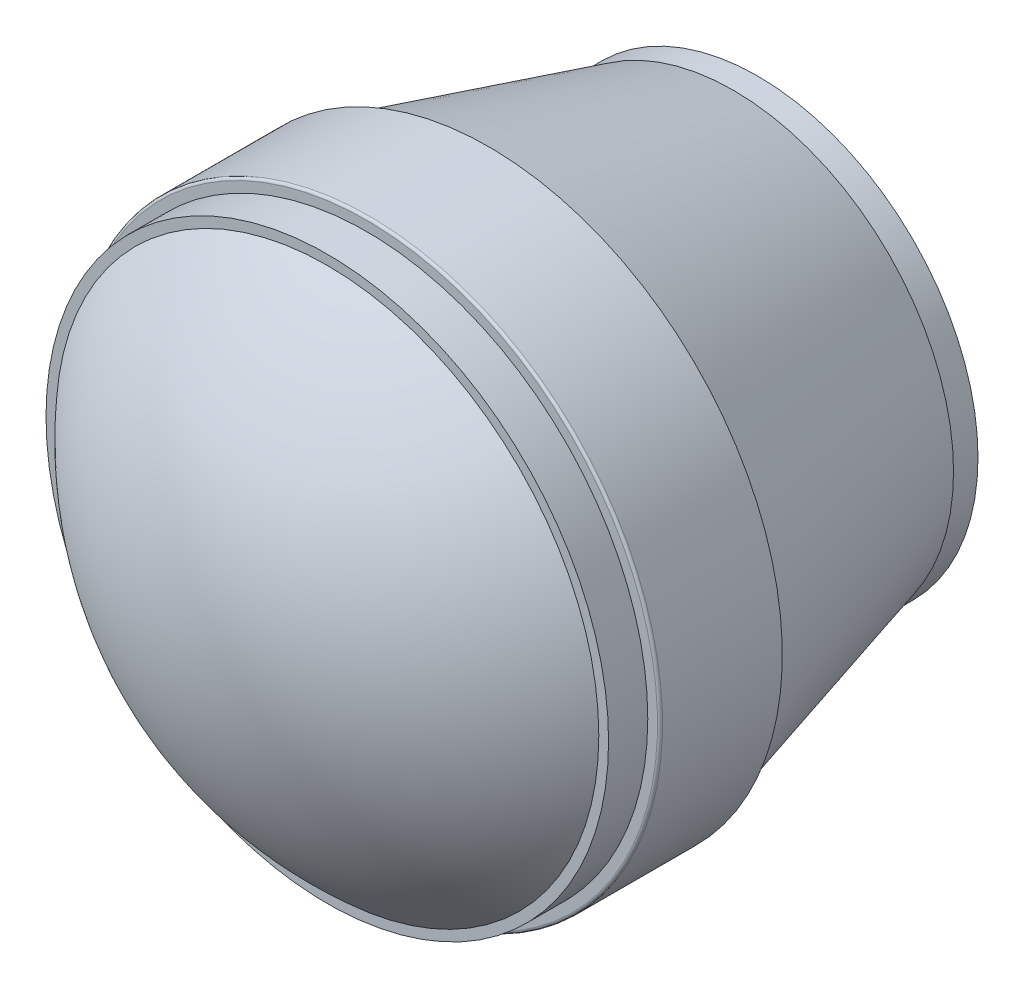
from build123d import *


with BuildPart() as part:
    # Sketch1 → Revolve1 (revolve)
    with BuildSketch(Plane(origin=(0, 0, 0), x_dir=(0, 0, -1), z_dir=(1, 0, 0)), mode=Mode.PRIVATE) as revolve1_sk:
        with BuildLine():
            Line((10, 0), (0, 0))
            add(Edge.make_bspline(
                [(0, 0), (3.5599e-05, 0.016666801), (0.000106798, 0.050001231), (0.000652865, 0.100002577), (0.001541965, 0.1500037), (0.00277976, 0.200005118), (0.00437987, 0.250006415), (0.006342127, 0.300007464), (0.008653546, 0.350008586), (0.011306301, 0.400010647), (0.014344795, 0.450011021), (0.017718859, 0.500012898), (0.021465187, 0.550013422), (0.025546859, 0.600015942), (0.030015342, 0.650015894), (0.03482081, 0.70001787), (0.039992041, 0.750019052), (0.045523257, 0.800020171), (0.051408883, 0.850022422), (0.057677216, 0.900021809), (0.064279583, 0.95002496), (0.071264406, 1.000025161), (0.078604568, 1.05002637), (0.086301292, 1.100028717), (0.094377045, 1.150028529), (0.102799423, 1.20003228), (0.111617788, 1.250030975), (0.120783561, 1.300033624), (0.130325404, 1.350034612), (0.140235292, 1.400035949), (0.150516909, 1.450036918), (0.161163804, 1.500039649), (0.17219876, 1.550039155), (0.183594648, 1.600042195), (0.195380444, 1.65004137), (0.207524249, 1.700045854), (0.220069218, 1.750045189), (0.232988482, 1.800046718), (0.246290189, 1.850047612), (0.259968354, 1.900050402), (0.274039825, 1.950051408), (0.288500418, 2.000052634), (0.303351068, 2.050053844), (0.318592454, 2.100054806), (0.334221213, 2.150057651), (0.350251722, 2.200058963), (0.366685967, 2.250057862), (0.383501889, 2.300062903), (0.40073359, 2.350063852), (0.418376737, 2.400063011), (0.436415737, 2.45006601), (0.454864866, 2.500069094), (0.473738026, 2.550068164), (0.493019727, 2.600068939), (0.512706128, 2.650074525), (0.532830884, 2.700072839), (0.553370049, 2.750076061), (0.574338539, 2.800079744), (0.595755257, 2.85007556), (0.61758101, 2.900081863), (0.639854553, 2.950081918), (0.66256348, 3.000085551), (0.685725632, 3.050086231), (0.7093363, 3.100087577), (0.733399151, 3.150087825), (0.757906071, 3.20009433), (0.782892021, 3.250091412), (0.808327595, 3.300098823), (0.834255389, 3.350093071), (0.860630848, 3.400102473), (0.88750378, 3.450102818), (0.914867347, 3.500100816), (0.942705478, 3.550107403), (0.971049019, 3.600107299), (0.999888878, 3.65011121), (1.029241659, 3.70011152), (1.059102526, 3.750114933), (1.089483632, 3.800118313), (1.120396235, 3.850118736), (1.151837467, 3.900122094), (1.183818601, 3.950125628), (1.216352043, 4.000125498), (1.249431788, 4.050132262), (1.283085623, 4.100131924), (1.317306062, 4.150136161), (1.352110512, 4.200135309), (1.387489417, 4.25014553), (1.423484922, 4.300141599), (1.460075424, 4.350148495), (1.497288074, 4.40015156), (1.53513209, 4.450151014), (1.57360284, 4.500160743), (1.612737012, 4.550160216), (1.652530339, 4.600162877), (1.692991663, 4.65017277), (1.734157348, 4.700168226), (1.776008892, 4.750178192), (1.81858317, 4.800180487), (1.861887951, 4.850182262), (1.905930073, 4.900195432), (1.95075691, 4.950189638), (1.996348781, 5.000203486), (2.042755705, 5.050200606), (2.089969588, 5.100213134), (2.13803612, 5.150217143), (2.186971133, 5.200222711), (2.236797623, 5.250226935), (2.287534309, 5.300237945), (2.339222476, 5.350244315), (2.391888284, 5.400253552), (2.445574222, 5.45025529), (2.500276259, 5.500295659), (2.537351737, 5.533372099), (2.55599, 5.55)],
                knots=[0, 0, 0, 0, 0.007942908, 0.015886211, 0.023830326, 0.031775625, 0.039722547, 0.047671504, 0.055622833, 0.063576922, 0.07153435, 0.079495335, 0.087460381, 0.095429767, 0.10340416, 0.111383685, 0.11936889, 0.127360179, 0.135357957, 0.143362824, 0.151374788, 0.159394667, 0.167422653, 0.175459144, 0.183504791, 0.191559748, 0.199624961, 0.207700294, 0.215786437, 0.223883802, 0.231992798, 0.240113836, 0.248247664, 0.256394356, 0.264554679, 0.272728682, 0.280917534, 0.289121281, 0.297340338, 0.305575119, 0.313826467, 0.322094811, 0.330380581, 0.338684203, 0.347006099, 0.355347174, 0.363707867, 0.372088108, 0.380489342, 0.388912021, 0.397356053, 0.405822412, 0.414312099, 0.422825001, 0.431361552, 0.439923369, 0.448510316, 0.457123451, 0.46576386, 0.474430749, 0.483125841, 0.491849606, 0.500603176, 0.50938703, 0.518201646, 0.527047492, 0.535926456, 0.544838318, 0.553785016, 0.56276558, 0.57178273, 0.580836987, 0.589928093, 0.599058103, 0.608227539, 0.617437722, 0.626689183, 0.635983268, 0.645321349, 0.654703976, 0.664132545, 0.673608478, 0.683132339, 0.69270646, 0.702331431, 0.712008739, 0.721738974, 0.731525502, 0.741368016, 0.751269015, 0.761230086, 0.77125187, 0.781337931, 0.791488944, 0.801706572, 0.811994513, 0.822352464, 0.832784196, 0.843291476, 0.853876085, 0.864542998, 0.875291944, 0.886128003, 0.897051998, 0.908069131, 0.919182484, 0.930395179, 0.941710372, 0.953133539, 0.9646691, 0.976321538, 0.988096569, 1, 1, 1, 1], degree=3))
            Line((2.55599, 5.55), (2.55599, 5.75))
            Line((2.55599, 5.75), (3.35748, 5.75))
            Line((3.35748, 5.75), (3.35748, 5.9492))
            ThreePointArc((3.35748, 5.9492), (3.372358976, 5.985121024), (3.40828, 6))
            Line((3.40828, 6), (5.85748, 6))
            Line((5.85748, 6), (5.85748, 5.873))
            Line((5.85748, 5.873), (10.85748, 4.5))
            Line((10.85748, 4.5), (11.35748, 4.5))
            Line((11.35748, 4.5), (11.35748, 3.25))
            add(Edge.make_bspline(
                [(10, 0), (10.000056861, 0.01666708), (10.000170592, 0.0500037), (10.001117916, 0.100007258), (10.002618837, 0.150010821), (10.004729124, 0.20001471), (10.007448952, 0.250018414), (10.010781755, 0.300021674), (10.014713511, 0.350025055), (10.019237073, 0.400029972), (10.024395369, 0.45003214), (10.030142728, 0.500036366), (10.0365002, 0.55004091), (10.043488845, 0.600042391), (10.051062088, 0.650048046), (10.059267779, 0.700050298), (10.068078377, 0.750053759), (10.077497714, 0.800058165), (10.087538544, 0.850061737), (10.098204423, 0.90006334), (10.10946822, 0.950069931), (10.121378341, 1.000069573), (10.1338821, 1.050076401), (10.147029343, 1.100077299), (10.160786514, 1.150082617), (10.175182904, 1.20008343), (10.190190402, 1.250088766), (10.205837242, 1.300089137), (10.222093378, 1.350096132), (10.238998481, 1.400096962), (10.256533003, 1.450097633), (10.27468071, 1.500104385), (10.29347393, 1.550106807), (10.312907874, 1.600107471), (10.332970002, 1.650110027), (10.353661774, 1.700114087), (10.374991067, 1.750119393), (10.396980392, 1.800115743), (10.419583602, 1.85012682), (10.442866046, 1.900119802), (10.46675986, 1.950130895), (10.491328563, 2.000128462), (10.516535034, 2.050137081), (10.542424605, 2.10013211), (10.568950372, 2.150143092), (10.596168084, 2.200140634), (10.624047647, 2.250148072), (10.652620792, 2.300151866), (10.681894818, 2.350153147), (10.711867243, 2.400159359), (10.742558203, 2.450168863), (10.774003866, 2.500169352), (10.806196749, 2.550175824), (10.839159562, 2.600187098), (10.872932785, 2.650196408), (10.907550175, 2.700198383), (10.943011873, 2.750216489), (10.979389434, 2.800226376), (11.016714764, 2.850240931), (11.055043535, 2.900253576), (11.094420826, 2.950276147), (11.134932562, 3.000293776), (11.176645078, 3.05032018), (11.219656781, 3.10034969), (11.264089006, 3.150364301), (11.309969614, 3.200456536), (11.341555497, 3.23339405), (11.35748, 3.25)],
                knots=[0, 0, 0, 0, 0.013871316, 0.027744679, 0.04162207, 0.055505482, 0.069397057, 0.083298853, 0.0972127, 0.11114058, 0.125085031, 0.139047518, 0.15303035, 0.167035925, 0.181065482, 0.195121849, 0.209206593, 0.223321686, 0.237469634, 0.251652447, 0.265871509, 0.28013002, 0.294428661, 0.308770726, 0.323157469, 0.337591571, 0.352074187, 0.366608018, 0.381194123, 0.395836109, 0.410534992, 0.425291675, 0.44010988, 0.454991472, 0.469937257, 0.484948997, 0.500029516, 0.5151817, 0.53040506, 0.545704772, 0.561079045, 0.576533165, 0.59206763, 0.607686658, 0.623389394, 0.639181429, 0.65506315, 0.671038969, 0.687112017, 0.703284041, 0.719559658, 0.735945077, 0.752442192, 0.769055912, 0.785794359, 0.802664341, 0.819669638, 0.836822213, 0.85413113, 0.871607402, 0.88926238, 0.907112993, 0.925174996, 0.943470086, 0.962020759, 0.980852187, 1, 1, 1, 1], degree=3))
        make_face()
    revolve(revolve1_sk.sketch.rotate(Axis((0, 0, -11.886951368), (0, 0, 1)), 90), axis=Axis((0, 0, -11.886951368), (0, 0, 1)))


solid = part.part
